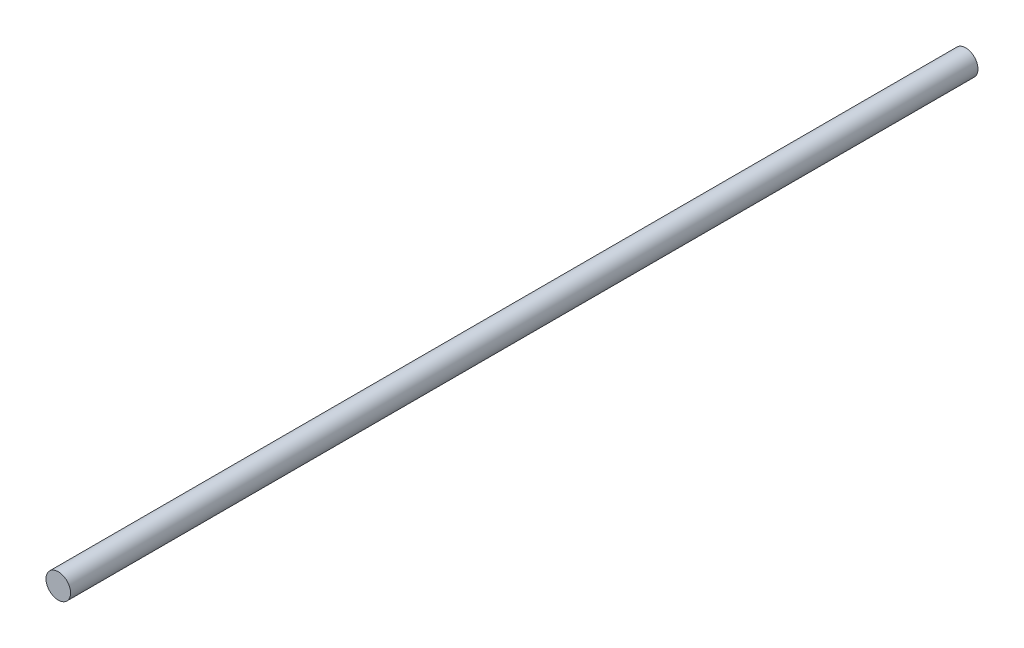
from build123d import *

# Parameters (mm, degrees)
ESQUISSE1_R        = 4
BOSS_EXTRU_1_DEPTH = 295


with BuildPart() as part:
    # Esquisse1 → Boss.-Extru.1 (new body)
    with BuildSketch(Plane.XY):
        Circle(ESQUISSE1_R)
    extrude(amount=BOSS_EXTRU_1_DEPTH)


solid = part.part
